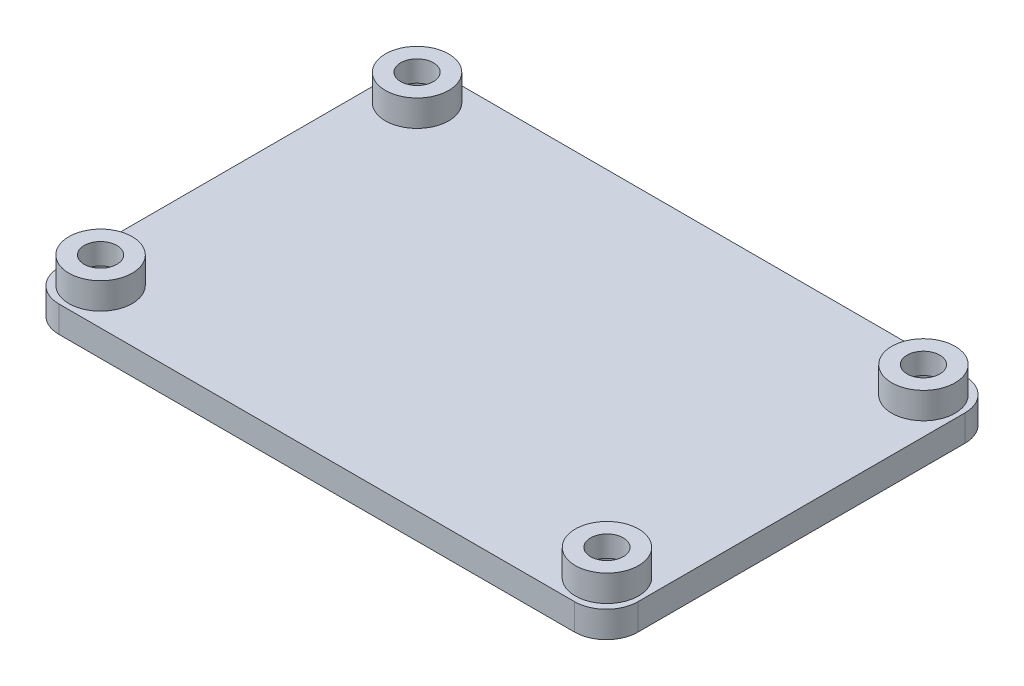
from build123d import *

# Parameters (mm, degrees)
SKETCH_1_R          = 1.55
EXTRUDE_1_DEPTH     = 2.5
SKETCH_2_R          = 3
EXTRUDE_2_DEPTH     = 2.5
SKETCH_3_R          = 1.55
CUT_EXTRUDE_1_DEPTH = 34.466573357
SKETCH_4_R          = 2.1
CUT_EXTRUDE_2_DEPTH = 3


with BuildPart() as part:
    # 草图1 → 凸台-拉伸1 (new body)
    with BuildSketch(Plane(origin=(0, 0, 0), x_dir=(1, 0, 0), z_dir=(0, 1, 0))):
        with BuildLine():
            Line((-27.4365, 0), (-27.4365, 15.5))
            ThreePointArc((-27.4365, 15.5), (-26.557820344, 17.621320344), (-24.4365, 18.5))
            Line((-24.4365, 18.5), (0, 18.5))
            Line((0, 18.5), (24.4365, 18.5))
            ThreePointArc((24.4365, 18.5), (26.557820344, 17.621320344), (27.4365, 15.5))
            Line((27.4365, 15.5), (27.4365, 0))
            Line((27.4365, 0), (27.4365, -15.5))
            ThreePointArc((27.4365, -15.5), (26.557820344, -17.621320344), (24.4365, -18.5))
            Line((24.4365, -18.5), (0, -18.5))
            Line((0, -18.5), (-24.4365, -18.5))
            ThreePointArc((-24.4365, -18.5), (-26.557820344, -17.621320344), (-27.4365, -15.5))
            Line((-27.4365, -15.5), (-27.4365, 0))
        make_face()
        with Locations((-24, 15)):
            Circle(SKETCH_1_R, mode=Mode.SUBTRACT)
        with Locations((24, 15)):
            Circle(SKETCH_1_R, mode=Mode.SUBTRACT)
        with Locations((24, -15)):
            Circle(SKETCH_1_R, mode=Mode.SUBTRACT)
        with Locations((-24, -15)):
            Circle(SKETCH_1_R, mode=Mode.SUBTRACT)
    extrude(amount=EXTRUDE_1_DEPTH)

    # 草图2 → 凸台-拉伸2 (add)
    with BuildSketch(Plane(origin=(0, 2.5, 0), x_dir=(1, 0, 0), z_dir=(0, 1, 0))):
        with Locations((-24, 15)):
            Circle(SKETCH_2_R)
        with Locations((24, 15)):
            Circle(SKETCH_2_R)
        with Locations((-24, -15)):
            Circle(SKETCH_2_R)
        with Locations((24, -15)):
            Circle(SKETCH_2_R)
    extrude(amount=EXTRUDE_2_DEPTH)

    # 草图3 → 切除-拉伸1 (cut, through all)
    with BuildSketch(Plane.XZ):
        with Locations((-24, 15)):
            Circle(SKETCH_3_R)
        with Locations((24, 15)):
            Circle(SKETCH_3_R)
        with Locations((-24, -15)):
            Circle(SKETCH_3_R)
        with Locations((24, -15)):
            Circle(SKETCH_3_R)
    extrude(amount=-CUT_EXTRUDE_1_DEPTH, mode=Mode.SUBTRACT)

    # 草图4 → 切除-拉伸2 (cut)
    with BuildSketch(Plane(origin=(0, 0, 0), x_dir=(-1, 0, 0), z_dir=(0, -1, 0))):
        with Locations((24, -15)):
            Circle(SKETCH_4_R)
        with Locations((-24, -15)):
            Circle(SKETCH_4_R)
        with Locations((-24, 15)):
            Circle(SKETCH_4_R)
        with Locations((24, 15)):
            Circle(SKETCH_4_R)
    extrude(amount=-CUT_EXTRUDE_2_DEPTH, mode=Mode.SUBTRACT)


solid = part.part
